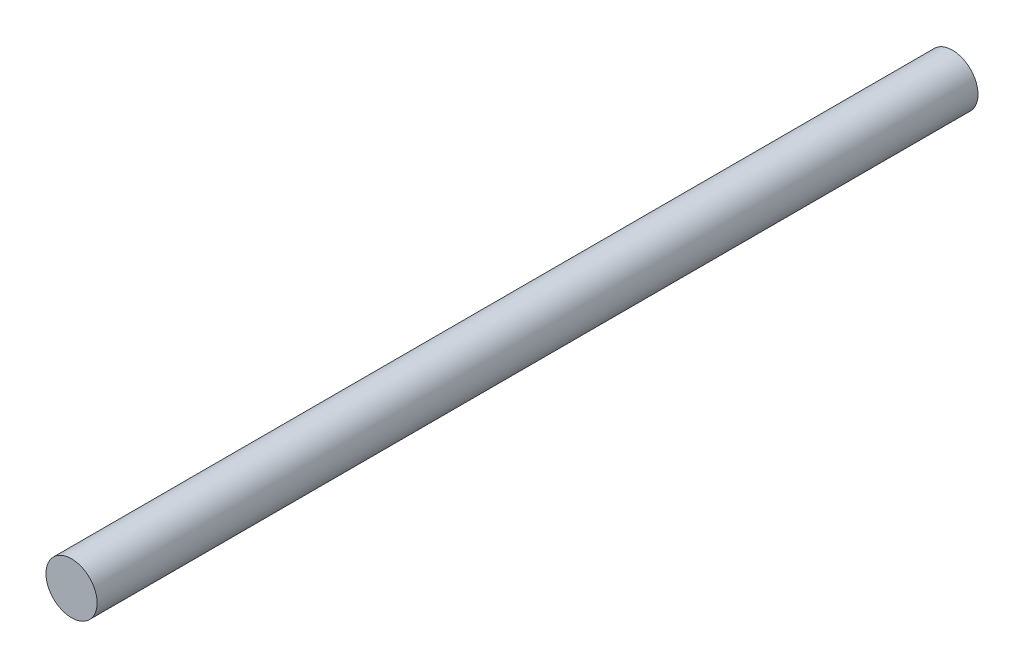
from build123d import *

# Parameters (mm, degrees)
SKETCH1_R          = 2.7
BASE_EXTRUDE_DEPTH = 93


with BuildPart() as part:
    # Sketch1 → Base-Extrude (new body)
    with BuildSketch(Plane.XY):
        Circle(SKETCH1_R)
    extrude(amount=-BASE_EXTRUDE_DEPTH)


solid = part.part
